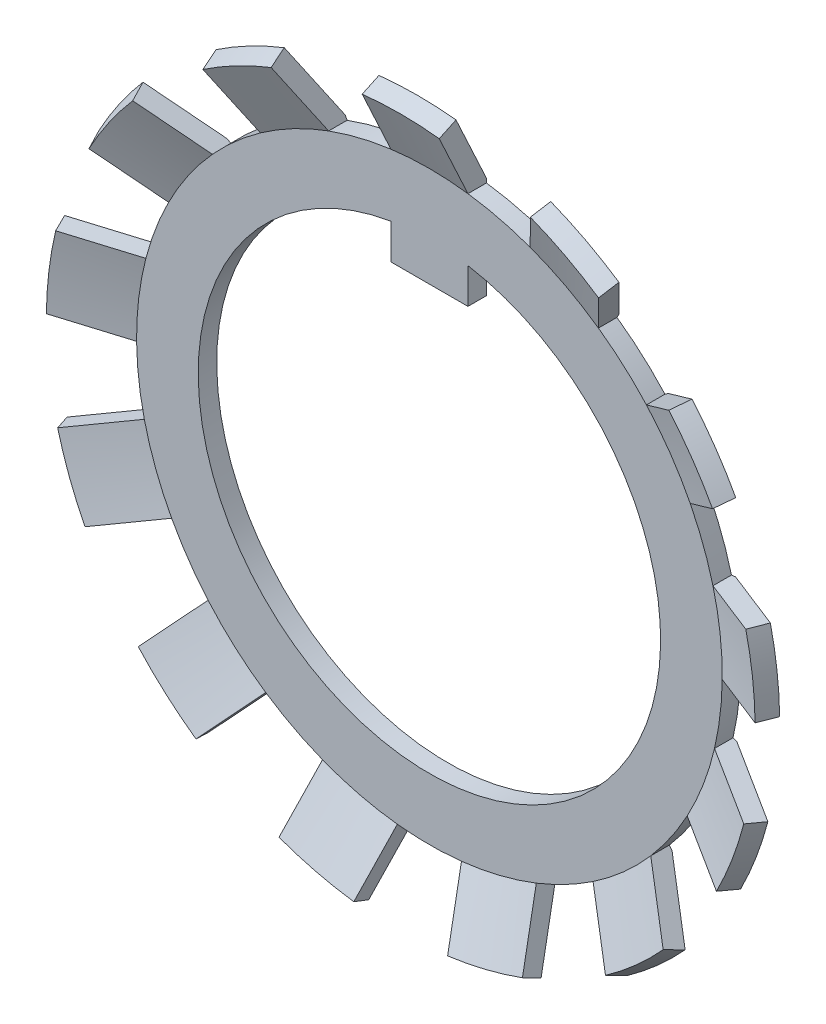
from build123d import *

# Parameters (mm, degrees)
CUT_EXTRUDE2_DEPTH  = 34.374769414
CIRPATTERN1_COUNT   = 13
BOSS_EXTRUDE1_START = -1.2
BOSS_EXTRUDE1_DEPTH = 1.2


with BuildPart() as part:
    # Sketch1 → Base-Revolve (revolve)
    with BuildSketch(Plane(origin=(0, 0, 0), x_dir=(0, 0, -1), z_dir=(1, 0, 0)), mode=Mode.PRIVATE) as base_revolve_sk:
        Polygon((0, 15), (0, 19.266033595), (-1.974330959, 23.5), (-3.061900303, 22.992858086), (-1.2, 19), (-1.2, 15), align=None)
    revolve(base_revolve_sk.sketch.rotate(Axis((0, 0, 14), (0, 0, -1)), 90), axis=Axis((0, 0, 14), (0, 0, -1)))

    # Sketch3 → Cut-Extrude2 (cut, through all)
    with BuildSketch(Plane(origin=(0, 0, 0), x_dir=(-1, 0, 0), z_dir=(0, 0, -1))):
        with BuildLine():
            Line((-2.5, 18.834808202), (-2.5, 23.366642891))
            ThreePointArc((-2.5, 23.366642891), (-5.623918111, 22.81713271), (-8.64538034, 21.851942677))
            Line((-8.64538034, 21.851942677), (-6.539331748, 17.839202344))
            ThreePointArc((-6.539331748, 17.839202344), (-4.546997621, 18.447894531), (-2.5, 18.834808202))
        make_face()
    cut_extrude2 = extrude(amount=-CUT_EXTRUDE2_DEPTH, mode=Mode.SUBTRACT)

    # CirPattern1: Cut-Extrude2 ×13 about axis
    cirpattern1_axis = Axis((0, 0, 0), (0, 0, 1))
    for i in range(1, CIRPATTERN1_COUNT):
        add(cut_extrude2.rotate(cirpattern1_axis, i * 360 / CIRPATTERN1_COUNT), mode=Mode.SUBTRACT)

    # Sketch4 → Boss-Extrude1 (add)
    with BuildSketch(Plane(origin=(0, 0, 0), x_dir=(-1, 0, 0), z_dir=(0, 0, -1)).offset(BOSS_EXTRUDE1_START)):
        with BuildLine():
            Line((-2.5, 14.790199458), (-2.5, 12.5))
            Line((-2.5, 12.5), (2.5, 12.5))
            Line((2.5, 12.5), (2.5, 14.790199458))
            ThreePointArc((2.5, 14.790199458), (0, 15), (-2.5, 14.790199458))
        make_face()
    extrude(amount=BOSS_EXTRUDE1_DEPTH)


solid = part.part
